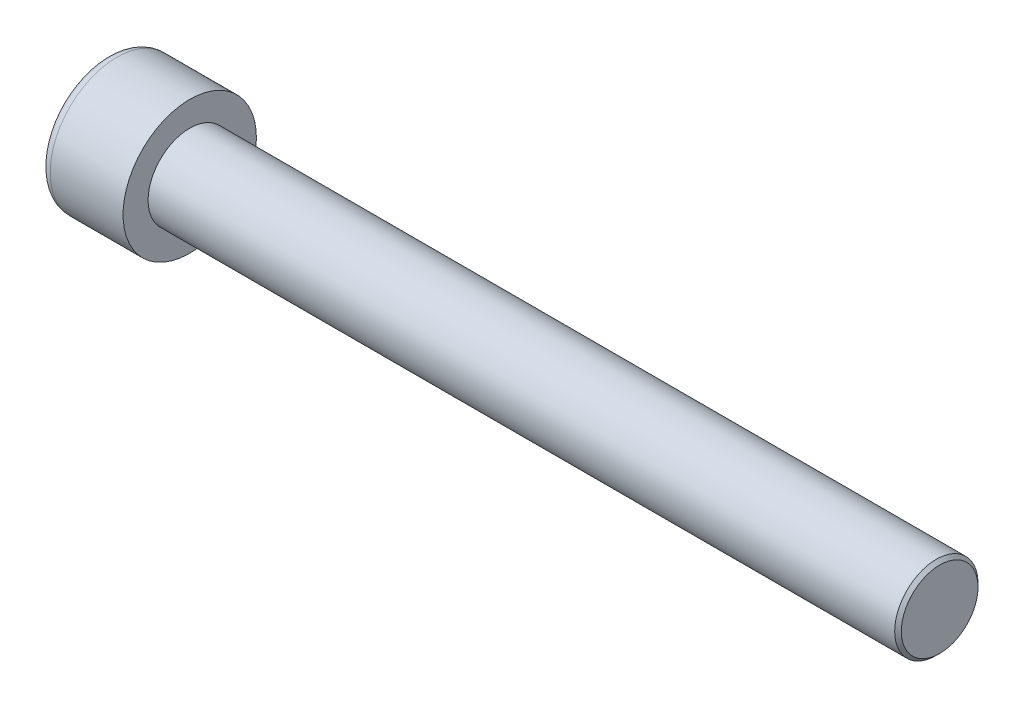
from build123d import *

# Parameters (mm, degrees)
SKETCH1_R           = 8
BASEHEAD_DEPTH      = 10
SKETCH2_R           = 5
BASEBODY_DEPTH      = 90
HEXAGONSOCKET_DEPTH = 5
TOPFILLET_R         = 1.25
CHAMFER1_SIZE       = 0.4


with BuildPart() as part:
    # Sketch1 → BaseHead (new body)
    with BuildSketch(Plane(origin=(0, 0, 0), x_dir=(0, 0, -1), z_dir=(1, 0, 0))):
        Circle(SKETCH1_R)
    extrude(amount=BASEHEAD_DEPTH)

    # Sketch2 → BaseBody (add)
    with BuildSketch(Plane(origin=(10, 0, 0), x_dir=(0, 0, -1), z_dir=(1, 0, 0))):
        with Locations(Location((0, 0, 0), (0, 0, 180))):
            Circle(SKETCH2_R)
    extrude(amount=BASEBODY_DEPTH)

    # Sketch3 → HexagonSocket (cut)
    with BuildSketch(Plane(origin=(0, 0, 0), x_dir=(0, 0, -1), z_dir=(1, 0, 0))):
        Polygon((4.618802154, 0), (2.309401077, 4), (-2.309401077, 4), (-4.618802154, 0), (-2.309401077, -4), (2.309401077, -4), align=None)
    extrude(amount=HEXAGONSOCKET_DEPTH, mode=Mode.SUBTRACT)

    # Sketch4 → Cut-Revolve1 (revolve, cut)
    with BuildSketch(Plane(origin=(-4.19613823, 0.75, 0), x_dir=(-1, 0, 0), z_dir=(0, 0, 1)), mode=Mode.PRIVATE) as cut_revolve1_sk:
        Polygon((-9.19613823, 4.75), (-11.505539306, 0.75), (-9.19613823, 0.75), align=None)
    revolve(cut_revolve1_sk.sketch.rotate(Axis((0.838992387, 0, 0), (-1, 0, 0)), 90), axis=Axis((0.838992387, 0, 0), (-1, 0, 0)), mode=Mode.SUBTRACT)

    # TopFillet
    topfillet_edges = [part.edges().sort_by_distance(p)[0] for p in [
        (0, 0, 8),
    ]]
    fillet(topfillet_edges, radius=TOPFILLET_R)

    # Chamfer1
    chamfer1_edges = [part.edges().sort_by_distance(p)[0] for p in [
        (100, 0, -5),
    ]]
    chamfer(chamfer1_edges, length=CHAMFER1_SIZE)


solid = part.part
